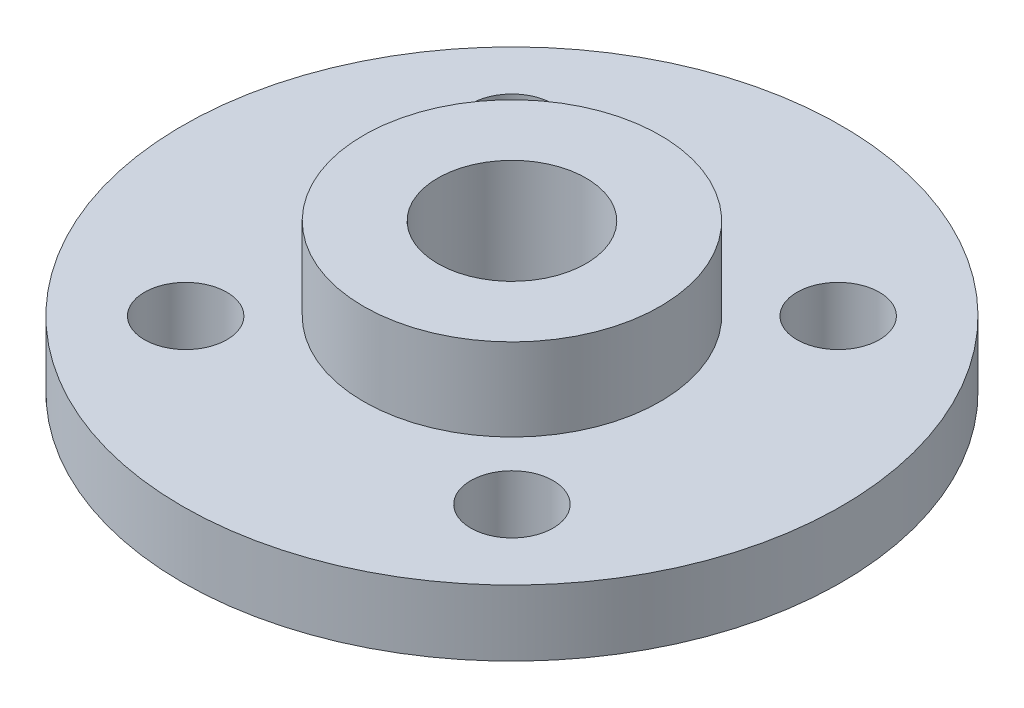
from build123d import *

# Parameters (mm, degrees)
SKETCH1_R           = 10
SKETCH1_R_2         = 1.25
SKETCH1_R_3         = 1.5
BOSS_EXTRUDE1_DEPTH = 2
SKETCH2_R           = 4.5
SKETCH2_R_2         = 1.5
BOSS_EXTRUDE2_DEPTH = 2.5
SKETCH3_R           = 2.25
CUT_EXTRUDE1_DEPTH  = 3.6


with BuildPart() as part:
    # Sketch1 → Boss-Extrude1 (new body)
    with BuildSketch(Plane(origin=(0, 0, 0), x_dir=(1, 0, 0), z_dir=(0, 1, 0))):
        with Locations(Location((0, 0, 0), (0, 0, 270))):
            Circle(SKETCH1_R)
        with Locations(Location((-4.949747468, 4.949747468, 0), (0, 0, 270))):
            Circle(SKETCH1_R_2, mode=Mode.SUBTRACT)
        with Locations(Location((4.949747468, 4.949747468, 0), (0, 0, 270))):
            Circle(SKETCH1_R_2, mode=Mode.SUBTRACT)
        with Locations(Location((4.949747468, -4.949747468, 0), (0, 0, 270))):
            Circle(SKETCH1_R_2, mode=Mode.SUBTRACT)
        with Locations(Location((-4.949747468, -4.949747468, 0), (0, 0, 270))):
            Circle(SKETCH1_R_2, mode=Mode.SUBTRACT)
        with Locations(Location((0, 0, 0), (0, 0, 270))):
            Circle(SKETCH1_R_3, mode=Mode.SUBTRACT)
    extrude(amount=BOSS_EXTRUDE1_DEPTH)

    # Sketch2 → Boss-Extrude2 (add)
    with BuildSketch(Plane(origin=(0, 2, 0), x_dir=(1, 0, 0), z_dir=(0, 1, 0))):
        with Locations(Location((0, 0, 0), (0, 0, 270))):
            Circle(SKETCH2_R)
        with Locations(Location((0, 0, 0), (0, 0, 270))):
            Circle(SKETCH2_R_2, mode=Mode.SUBTRACT)
    extrude(amount=BOSS_EXTRUDE2_DEPTH)

    # Sketch3 → Cut-Extrude1 (cut)
    with BuildSketch(Plane(origin=(0, 4.5, 0), x_dir=(1, 0, 0), z_dir=(0, 1, 0))):
        with Locations(Location((0, 0, 0), (0, 0, 270))):
            Circle(SKETCH3_R)
    extrude(amount=-CUT_EXTRUDE1_DEPTH, mode=Mode.SUBTRACT)


solid = part.part
